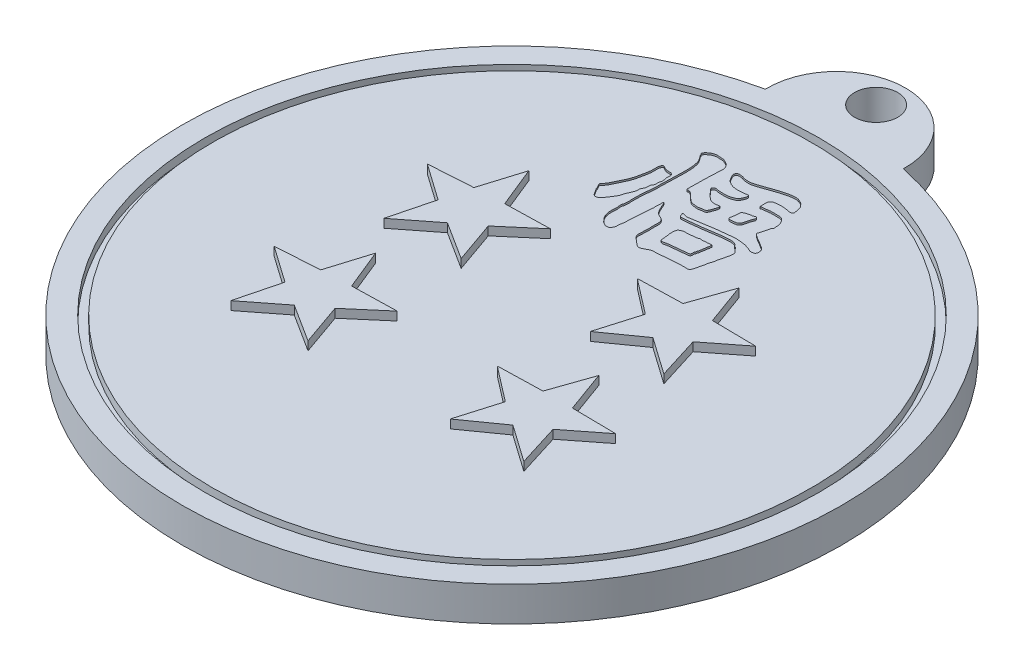
from build123d import *

# Parameters (mm, degrees)
SKETCH2_R           = 48.586041816
BOSS_EXTRUDE1_DEPTH = 5.08
SKETCH3_R           = 45.261162742
SKETCH3_R_2         = 44.114495039
CUT_EXTRUDE1_DEPTH  = 1.27
BOSS_EXTRUDE4_DEPTH = 1.27
SKETCH6_R           = 3.175
BOSS_EXTRUDE5_DEPTH = 5.08
CUT_EXTRUDE2_DEPTH  = 0.254


with BuildPart() as part:
    # Sketch2 → Boss-Extrude1 (new body)
    with BuildSketch(Plane(origin=(0, 0, 0), x_dir=(1, 0, 0), z_dir=(0, 1, 0))):
        with Locations(Location((0, 0, 0), (0, 0, 270))):
            Circle(SKETCH2_R)
    extrude(amount=BOSS_EXTRUDE1_DEPTH)

    # Sketch3 → Cut-Extrude1 (cut)
    with BuildSketch(Plane(origin=(0, 5.08, 0), x_dir=(1, 0, 0), z_dir=(0, 1, 0))):
        with Locations(Location((0, 0, 0), (0, 0, 270))):
            Circle(SKETCH3_R)
        with Locations(Location((0, 0, 0), (0, 0, 270))):
            Circle(SKETCH3_R_2, mode=Mode.SUBTRACT)
    extrude(amount=-CUT_EXTRUDE1_DEPTH, mode=Mode.SUBTRACT)

    # Sketch5 → Boss-Extrude4 (add)
    with BuildSketch(Plane(origin=(0, 5.08, 0), x_dir=(1, 0, 0), z_dir=(0, 1, 0))):
        Polygon((19.962692336, 2.42080456), (14.520621312, 6.248899488), (9.132932153, 2.42080456), (10.97803118, 8.674719156), (5.831176, 12.63682654), (12.395844117, 12.811625395), (14.520621312, 18.904336603), (16.734740144, 12.811625395), (23.190644529, 12.724225968), (18.016598415, 8.674719156), align=None)
        Polygon((13.248420457, -8.675505868), (15.373197652, -2.58279466), (17.587316485, -8.675505868), (24.043220869, -8.762905296), (18.869174756, -12.812412107), (20.815268677, -19.066326704), (15.373197652, -15.238231775), (9.985508494, -19.066326704), (11.830607521, -12.812412107), (6.68375234, -8.850304723), align=None)
        Polygon((-7.696814368, -9.215129018), (-14.261901219, -9.373422293), (-16.692881447, -3.396287267), (-18.595215819, -9.593429834), (-25.038383853, -10.008069147), (-19.665659674, -13.790012231), (-21.292139954, -20.134560381), (-16.051176371, -16.035444801), (-10.476310855, -19.58542786), (-12.636146644, -13.433115485), align=None)
        Polygon((-15.273489298, 5.757628034), (-9.698623782, 2.207644974), (-11.858459571, 8.359957349), (-6.919127295, 12.577943816), (-13.484214146, 12.419650541), (-15.915194374, 18.396785567), (-17.817528745, 12.199643), (-24.26069678, 11.785003687), (-18.887972601, 8.003060603), (-20.514452881, 1.658512453), align=None)
    extrude(amount=BOSS_EXTRUDE4_DEPTH)

    # Sketch6 → Boss-Extrude5 (add)
    with BuildSketch(Plane.XZ):
        with BuildLine():
            ThreePointArc((-10.16, -47.51187072), (0, -57.996644064), (10.16, -47.51187072))
            ThreePointArc((10.16, -47.51187072), (0, -48.586041816), (-10.16, -47.51187072))
        make_face()
        with Locations(Location((0, -53.666041816, 0), (0, 0, 270))):
            Circle(SKETCH6_R, mode=Mode.SUBTRACT)
    extrude(amount=-BOSS_EXTRUDE5_DEPTH)

    # Sketch8 → Cut-Extrude2 (cut)
    # profile 1 of 2: a face of its own
    with BuildSketch(Plane(origin=(0, 5.08, 0), x_dir=(1, 0, 0), z_dir=(0, 1, 0))):
        with BuildLine():
            add(Edge.make_bspline(
                [(-9.104848345, 21.317431694), (-9.003346051, 21.286647468), (-8.732647095, 21.279329128), (-8.445618917, 21.626370385), (-8.044697085, 22.011271969), (-7.797460235, 22.499600356), (-7.481449352, 22.929809827), (-7.285706933, 23.31825522), (-7.214177228, 23.795770809), (-7.010756161, 24.186758616), (-6.83011197, 24.643808959), (-6.622316609, 25.079138603), (-6.741430305, 25.585315983), (-6.431527486, 25.95121832), (-6.358479909, 26.365548715), (-6.440354454, 26.826861176), (-6.085696183, 27.118766471), (-6.189041229, 27.702083205), (-5.913044431, 28.311526098), (-6.230873285, 28.997010378), (-5.993091818, 29.635727169), (-6.491217066, 29.936112861), (-7.026573168, 29.817646436), (-7.467064941, 30.024518662), (-7.977918649, 30.3511747), (-8.161211447, 29.886074534), (-8.191311435, 29.450315644), (-8.152398152, 28.663584787), (-8.315933089, 27.77763375), (-8.53321778, 26.766298101), (-8.870609527, 25.761833146), (-9.41515839, 24.777842714), (-9.762517841, 23.881680268), (-10.151537925, 23.49958421), (-10.3810471, 23.178026492), (-10.071804629, 22.796847287), (-9.966154919, 22.313130325), (-9.598453722, 21.887797523), (-9.423430742, 21.485140893), (-9.198840957, 21.345938338), (-9.104848345, 21.317431694)],
                knots=[0, 0, 0, 0, 0.014630573, 0.035132969, 0.059376301, 0.094604923, 0.111141198, 0.135283802, 0.155282263, 0.178949579, 0.197060234, 0.225532505, 0.244950236, 0.265182514, 0.288670525, 0.303213642, 0.328412659, 0.341943786, 0.383250745, 0.415940039, 0.444177865, 0.463684072, 0.484306129, 0.519131226, 0.534692133, 0.554785085, 0.570505957, 0.601086519, 0.663574153, 0.698481307, 0.747794866, 0.812749429, 0.859505638, 0.879040139, 0.89271263, 0.908414068, 0.939586103, 0.963933795, 0.986451875, 1, 1, 1, 1], degree=3))
        make_face()
    # profile 2 of 2: a face of its own
    with BuildSketch(Plane(origin=(0, 5.08, 0), x_dir=(1, 0, 0), z_dir=(0, 1, 0))):
        with BuildLine():
            add(Edge.make_bspline(
                [(-3.520760811, 35.083924843), (-3.589856484, 35.129465567), (-3.783563784, 35.204450351), (-4.043533621, 35.381140107), (-4.390213777, 35.506268144), (-4.833761087, 35.496235122), (-5.296725256, 35.569763966), (-5.710402342, 35.473189403), (-5.986094193, 35.368053904), (-6.130357363, 35.158503673), (-6.440307711, 35.091549805), (-6.620078759, 34.836173389), (-6.735902924, 34.508455764), (-6.514475909, 34.404571636), (-6.499200515, 34.218567975), (-6.353215576, 34.09636012), (-6.300524669, 33.933373683), (-6.163591052, 33.853801957), (-6.145091114, 33.711395454), (-6.012431792, 33.600089853), (-5.957948886, 33.388378014), (-5.815758653, 33.203419425), (-5.81061032, 32.900519481), (-5.692504102, 32.571532894), (-5.689823445, 32.080019174), (-5.630301399, 31.535636381), (-5.635389467, 30.855940064), (-5.695592259, 30.158951511), (-5.685563485, 29.34856937), (-5.742267058, 28.585954412), (-5.744296563, 27.944972006), (-5.753316251, 27.42495417), (-5.707009426, 26.998180975), (-5.793701119, 26.592378281), (-5.769443491, 26.23468937), (-5.825525349, 25.818505109), (-5.93881339, 25.304011235), (-5.885200573, 24.747153245), (-5.920338873, 24.232012622), (-5.920990995, 23.813516043), (-5.958848496, 23.466859363), (-5.887968161, 23.215754353), (-5.909546267, 22.949413522), (-5.951044958, 22.695250033), (-5.955140079, 22.421934686), (-6.139941754, 22.092863058), (-5.952878911, 21.658650762), (-6.05031285, 21.209046963), (-6.012577932, 20.837581251), (-6.047469717, 20.581547254), (-6.03073377, 20.360798615), (-6.012182142, 20.187962925), (-5.984953557, 19.987529531), (-5.881056588, 19.848223728), (-5.899798203, 19.692224248), (-5.820078229, 19.525848715), (-5.703580912, 19.345556995), (-5.588333396, 19.134634924), (-5.418401646, 18.966917351), (-5.265880908, 18.790463006), (-5.129549817, 18.63457692), (-4.950965103, 18.516804635), (-4.761058, 18.403800179), (-4.52306871, 18.273166768), (-4.267336399, 18.319336042), (-4.019983797, 18.319841527), (-3.905853443, 18.523874983), (-3.726723583, 18.681309883), (-3.632451254, 18.984114612), (-3.686468926, 19.34207768), (-3.58351566, 19.770714021), (-3.507724922, 20.21141807), (-3.538826694, 20.925735872), (-3.440222585, 21.5666807), (-3.387677158, 22.228546149), (-3.39547542, 22.573483452), (-3.338502986, 22.920226848), (-3.363118104, 23.255321115), (-3.296829492, 23.61481331), (-3.284664019, 23.934733258), (-3.231029717, 24.222333708), (-3.320358331, 24.460749979), (-3.238992762, 24.695719974), (-3.278334652, 24.919827116), (-3.22311878, 25.164995083), (-3.25945278, 25.335917707), (-3.200779882, 25.623254983), (-3.099523398, 25.472566009), (-3.050740377, 25.364940535), (-2.94869592, 25.218808297), (-2.917501401, 25.033010608), (-2.826968609, 24.859973184), (-2.744389673, 24.710872394), (-2.666106418, 24.509734551), (-2.575680705, 24.315877717), (-2.429676714, 24.114457021), (-2.313513587, 23.882739805), (-2.073213447, 23.674970135), (-1.758109229, 23.483660627), (-1.428732176, 23.393500915), (-1.153325804, 23.181290784), (-0.999303549, 22.908880913), (-0.954672244, 22.510341085), (-1.015872957, 22.037773234), (-0.935799002, 21.308061719), (-0.984969184, 20.643187015), (-0.993764892, 19.979025631), (-1.070032824, 19.549324376), (-0.896389633, 19.218221018), (-0.736872325, 18.974399547), (-0.46120489, 18.796132796), (-0.178892307, 18.531457595), (0.152062359, 18.261680044), (0.476038297, 17.990005521), (0.87733161, 17.972899464), (1.213425508, 18.168295579), (1.575105718, 18.347668443), (2.073017737, 18.615926675), (2.651162091, 18.53627586), (3.215576644, 18.666885689), (3.726352007, 18.661225176), (4.239450303, 18.72007426), (4.775093951, 18.75416958), (5.364925451, 18.827376419), (6.004606008, 18.832540923), (6.606075086, 18.869554862), (7.087544371, 18.777916415), (7.397625883, 19.011873901), (7.445552282, 19.346570558), (7.570397957, 19.672807492), (7.625999392, 20.090873335), (7.794929158, 20.485762721), (7.80433204, 20.944576017), (7.941676891, 21.344939223), (8.077158772, 21.710215794), (8.079110654, 22.063414123), (8.194381149, 22.372261038), (8.257161971, 22.722259768), (8.366387599, 23.053957566), (8.38858232, 23.389678502), (8.530161256, 23.672850172), (8.492787138, 23.966442296), (8.599394103, 24.297210041), (8.277589453, 24.596880827), (8.034118587, 24.802630541), (7.851692225, 25.197677069), (7.64477239, 25.028650248), (7.545239673, 25.409742933), (7.294753546, 25.526424151), (7.026481586, 25.656220263), (6.659138035, 25.700147445), (6.212718072, 25.673306641), (5.589770931, 25.634222817), (4.925635493, 25.557576083), (4.224064243, 25.442782799), (3.613000908, 25.378234174), (3.100257735, 25.255698047), (2.568327118, 25.213036584), (2.009970458, 25.140819585), (1.388610784, 25.070852937), (0.827762163, 24.987972016), (0.370998924, 25.018471151), (0.048596099, 24.906068805), (-0.178179726, 25.002186201), (-0.321945877, 25.1436401), (-0.320311766, 25.348761229), (-0.565425716, 25.721185086), (0.135916803, 25.376700281), (0.549600924, 25.442163287), (1.105573494, 25.496267761), (1.665863245, 25.601367283), (2.350965622, 25.720095818), (3.006787263, 25.77289054), (3.657068342, 25.964949369), (4.228725901, 26.024053768), (4.812456559, 26.090205154), (5.336857593, 26.180439344), (5.81477338, 26.200143009), (6.269365133, 26.310240694), (6.740878392, 26.298159917), (7.231000029, 26.267918358), (7.69781807, 26.203296423), (8.207817139, 26.150882865), (8.653619209, 25.992293888), (9.032264659, 25.864945812), (9.357853234, 25.67927243), (9.687458317, 25.682921057), (10.003650005, 25.744495645), (10.142396045, 25.95432452), (10.207641358, 26.188798813), (10.104099349, 26.365960594), (10.158399398, 26.568721704), (9.982286157, 26.763361124), (9.831741368, 27.011435684), (9.546900217, 27.134042434), (9.285406947, 27.302826152), (9.002590267, 27.491106521), (8.697570267, 27.676352618), (8.369310903, 27.833905094), (8.122516704, 28.032087993), (7.848165092, 28.165044674), (7.648566174, 28.324271257), (7.592673815, 28.561442551), (7.721207004, 28.741685655), (7.719329064, 28.971501601), (7.849511049, 29.20562857), (7.887518068, 29.510455693), (8.006508704, 29.823124317), (8.022314851, 30.149110864), (8.25985222, 30.337318193), (8.183735494, 30.637626306), (8.193658305, 30.920372642), (8.156813307, 31.284002896), (7.992583705, 31.620212806), (7.79581181, 31.959751689), (7.594767824, 32.148039887), (7.388440525, 32.256531154), (7.203115713, 32.320138881), (6.949221091, 32.316252077), (6.59200789, 32.316078485), (6.202508809, 32.327504277), (5.778437933, 32.349065144), (5.471626652, 32.258425355), (5.127074513, 32.255137801), (4.851105548, 32.175925318), (4.613830954, 32.206862825), (4.393898598, 32.030104469), (4.442736172, 32.32998017), (4.40076427, 32.513551042), (4.424580168, 32.776505371), (4.393520976, 32.998352405), (4.402071473, 33.228515895), (4.541321457, 33.383575874), (4.654810488, 33.505922892), (4.735937459, 33.658002398), (4.931617607, 33.708258542), (5.206462237, 33.707928588), (5.611923622, 33.784120975), (6.113775785, 33.786639323), (6.609957532, 33.735082834), (7.003110842, 33.672623012), (7.289284773, 33.598083313), (7.510975504, 33.597928425), (7.639562998, 33.725925691), (7.785352093, 33.863395367), (7.696661353, 34.130147688), (7.676940656, 34.424285393), (7.577059114, 34.750300395), (7.468704804, 35.07985743), (7.231576134, 35.316393064), (7.03171338, 35.560143409), (6.688093344, 35.743739665), (6.294193073, 35.918434881), (5.851907808, 35.953526933), (5.412505944, 35.910992094), (4.983096041, 35.846895344), (4.527963143, 35.707946456), (4.093009272, 35.610087923), (3.581937106, 35.4538998), (3.002248008, 35.198178417), (2.314394324, 35.028042338), (1.688983119, 34.769947147), (1.107031682, 34.629262316), (0.604919431, 34.44503281), (0.167720762, 34.519184487), (-0.254432975, 34.488667103), (-0.597319357, 34.678151842), (-0.987079419, 34.716482427), (-1.306200955, 34.762232058), (-1.620373113, 34.586605929), (-1.672701161, 34.276426358), (-1.569726794, 34.00458517), (-1.397405, 33.781824982), (-1.311875481, 33.482992273), (-1.092722596, 33.269232893), (-0.945582115, 33.03325716), (-0.682103847, 33.011042786), (-0.585968043, 32.827736345), (-0.36040449, 32.817784887), (-0.176483091, 32.682271628), (0.105856431, 32.631531989), (0.529465796, 32.559654989), (1.10044176, 32.658566713), (1.638980596, 32.628752626), (2.468474099, 32.860840195), (2.041223129, 31.920059069), (1.786738356, 31.449652608), (1.38373494, 31.354928934), (0.969874906, 31.127964525), (0.370796956, 31.06644206), (-0.123073031, 31.080461807), (-0.609025506, 31.118513433), (-0.894105897, 31.135636215), (-1.173539759, 31.234357968), (-1.301399203, 31.059883497), (-1.589914332, 31.031619546), (-1.455589752, 30.718281053), (-1.281786057, 30.495992003), (-0.976313761, 30.220729785), (-0.662009313, 29.838873356), (-0.31320447, 29.536626191), (0.013455595, 29.270100242), (0.320439439, 29.164239939), (0.620214609, 29.170766701), (0.947791042, 29.100252651), (1.745747582, 29.488616364), (1.271299198, 28.312527943), (1.088428606, 27.858623923), (0.969831068, 27.657226423), (0.734431391, 27.588615321), (0.40972387, 27.592651602), (-0.031028633, 27.44408152), (-0.532827675, 27.504437364), (-0.943143842, 27.545546202), (-1.285387809, 27.705385287), (-1.586097038, 27.90799455), (-1.866897853, 28.238373378), (-2.185671677, 28.46750051), (-2.418794241, 28.767538782), (-2.700856249, 28.860872873), (-2.919845881, 28.98088581), (-3.153395936, 28.825603901), (-3.20198274, 29.150767465), (-3.176294672, 29.492277583), (-3.164395681, 30.040499176), (-3.145484643, 30.678740882), (-3.177716203, 31.395375719), (-3.126256908, 32.164144164), (-3.06441096, 32.93080722), (-3.124906197, 33.63038819), (-3.005212945, 34.177037018), (-3.138935855, 34.599122622), (-3.29151849, 34.874096884), (-3.449669527, 35.037068819), (-3.520760811, 35.083924843)],
                knots=[0, 0, 0, 0, 0.002019768, 0.004974467, 0.007629086, 0.010793259, 0.015676763, 0.018828711, 0.02107473, 0.022596702, 0.024739207, 0.028215777, 0.030103132, 0.03177807, 0.033004073, 0.034281483, 0.036191879, 0.036944, 0.037886265, 0.039391451, 0.040919349, 0.043071248, 0.044840566, 0.048066933, 0.051489012, 0.056662604, 0.06138691, 0.067957772, 0.07364511, 0.081048916, 0.086516261, 0.089204758, 0.093686482, 0.096843479, 0.09917351, 0.102343662, 0.107012262, 0.111882114, 0.115805003, 0.119538277, 0.122068647, 0.124179369, 0.125761621, 0.128499241, 0.130467988, 0.132297067, 0.137281916, 0.140631813, 0.143342142, 0.146280436, 0.146857716, 0.148710895, 0.150527104, 0.151677827, 0.152717471, 0.154151189, 0.156028088, 0.157977816, 0.159935846, 0.161785441, 0.163659194, 0.164926979, 0.166942163, 0.169110325, 0.171185354, 0.17323464, 0.174464044, 0.176509368, 0.179023037, 0.18171132, 0.185208895, 0.1895911, 0.192547909, 0.202508892, 0.205267227, 0.208670575, 0.210861046, 0.213765878, 0.216766673, 0.219683548, 0.221562467, 0.223762254, 0.225540528, 0.227337188, 0.229257627, 0.231206754, 0.232682984, 0.233333816, 0.23459964, 0.235917474, 0.237476943, 0.239118546, 0.240622711, 0.241616383, 0.244357031, 0.245781602, 0.24765078, 0.250596903, 0.25332019, 0.256577335, 0.258763821, 0.261598958, 0.26389604, 0.268389431, 0.273106701, 0.281645457, 0.284474863, 0.289360726, 0.291672581, 0.293352537, 0.296391593, 0.299482748, 0.302749214, 0.306848378, 0.309352418, 0.311918169, 0.316106985, 0.319287517, 0.32535597, 0.32959198, 0.333311608, 0.337698892, 0.342131564, 0.346341523, 0.352129967, 0.357595129, 0.361147776, 0.363388659, 0.366125033, 0.369021583, 0.371906653, 0.376291546, 0.37929094, 0.382904743, 0.386518545, 0.388656558, 0.391374494, 0.394436115, 0.397291205, 0.399809381, 0.402546675, 0.404675259, 0.406883845, 0.410387427, 0.413550038, 0.416460081, 0.416755168, 0.419436479, 0.421789005, 0.424017783, 0.426486013, 0.430694556, 0.434864081, 0.441648839, 0.446916195, 0.452129458, 0.456555621, 0.45968137, 0.465072267, 0.470225772, 0.474888116, 0.478765608, 0.481353542, 0.482655461, 0.484620994, 0.485690103, 0.487732633, 0.492167825, 0.495610621, 0.499655189, 0.505180942, 0.509637729, 0.516494044, 0.521109822, 0.526032369, 0.530414934, 0.535384853, 0.538938736, 0.541996463, 0.546683015, 0.550298145, 0.553933606, 0.558129716, 0.562696921, 0.565358471, 0.567846977, 0.571641316, 0.573103969, 0.575415219, 0.577284541, 0.578677852, 0.580085583, 0.581930349, 0.584546226, 0.587102909, 0.589176761, 0.592150219, 0.595338305, 0.597841689, 0.600968979, 0.602948916, 0.605263575, 0.606953313, 0.608212624, 0.610386244, 0.612294961, 0.614593181, 0.617740804, 0.620485559, 0.622032177, 0.624403946, 0.627072537, 0.629144833, 0.633144752, 0.63602763, 0.638666582, 0.639669925, 0.641688014, 0.643331735, 0.645795495, 0.650377304, 0.652809478, 0.656044606, 0.658009338, 0.661198809, 0.662660354, 0.66422062, 0.665358179, 0.667855324, 0.669624459, 0.671492351, 0.673404323, 0.674895267, 0.676375466, 0.677525238, 0.678874621, 0.680933819, 0.684307092, 0.6887934, 0.693077325, 0.696442306, 0.698375038, 0.700412317, 0.701273032, 0.702744398, 0.704879553, 0.707277923, 0.710108675, 0.713088253, 0.715538665, 0.718134959, 0.720674815, 0.724879386, 0.728527996, 0.731277507, 0.735608436, 0.739036774, 0.742818595, 0.74643318, 0.751997451, 0.758163191, 0.76359702, 0.768354599, 0.772775213, 0.776248202, 0.778948605, 0.782884075, 0.785337379, 0.788476051, 0.790478156, 0.79341676, 0.795105901, 0.797491105, 0.800190854, 0.802394185, 0.804931392, 0.806401536, 0.808312288, 0.809143927, 0.811628159, 0.813645568, 0.816032877, 0.822076307, 0.827142851, 0.830177742, 0.838846511, 0.840203756, 0.843450386, 0.847917749, 0.851873502, 0.85774559, 0.860034777, 0.863575353, 0.865133343, 0.866177679, 0.868443506, 0.87012468, 0.872636863, 0.875866036, 0.879848597, 0.884697844, 0.887032624, 0.890047084, 0.892336271, 0.894218974, 0.898361948, 0.907786759, 0.910014105, 0.911531002, 0.913105974, 0.9156458, 0.919465217, 0.924119378, 0.927766356, 0.929372684, 0.933240889, 0.936470061, 0.939822505, 0.942763924, 0.945390002, 0.946913461, 0.948656778, 0.94994618, 0.953045039, 0.958022196, 0.962752736, 0.968706366, 0.975367527, 0.98147295, 0.987335688, 0.992404472, 0.994610169, 0.997921898, 1, 1, 1, 1], degree=3))
        make_face()
        with BuildLine():
            add(Edge.make_bspline(
                [(1.450213942, 20.547539352), (1.490799237, 20.512653883), (1.66828616, 20.463118601), (1.921835696, 20.468227206), (2.222208873, 20.557805543), (2.557558477, 20.62209593), (2.974535249, 20.622218314), (3.381161402, 20.71402697), (3.780485068, 20.739991426), (4.113701091, 20.748252352), (4.380875092, 20.795983502), (4.596470164, 20.818363494), (4.792974404, 20.84937653), (5.015585217, 20.879541145), (5.226643991, 20.884862435), (5.38746812, 21.008655576), (5.396550494, 21.172089003), (5.400646262, 21.319891514), (5.372697752, 21.488933572), (5.510226325, 21.629047829), (5.440501615, 21.830176464), (5.576568591, 21.93301027), (5.561567559, 22.075249946), (5.585094857, 22.181756091), (5.624763451, 22.346621171), (5.63395899, 22.524894704), (5.674966114, 22.740271915), (5.688106605, 22.947188596), (5.749091048, 23.158378533), (5.818368877, 23.355186082), (5.728289898, 23.536855134), (5.91431309, 23.665238581), (5.601340814, 23.676982262), (5.414478897, 23.68801375), (5.192942162, 23.599050267), (4.934693994, 23.627680826), (4.699525726, 23.603228332), (4.463119609, 23.504657594), (4.206402513, 23.691988314), (3.876987515, 23.454189996), (3.511291622, 23.461580072), (3.136414176, 23.418315893), (2.693332191, 23.321448609), (2.24648015, 23.351122731), (1.818878789, 23.363117132), (1.622133691, 23.156165864), (1.327830933, 23.118281261), (1.298022156, 22.828111731), (1.185414636, 22.585849564), (1.246286941, 22.287368784), (1.215570991, 21.987282623), (1.304652381, 21.654263285), (1.308999526, 21.290188216), (1.38683121, 20.928724219), (1.362754335, 20.622716073), (1.450213942, 20.547539352)],
                knots=[0, 0, 0, 0, 0.012641468, 0.036145391, 0.055719513, 0.079986945, 0.110064029, 0.145637033, 0.169912598, 0.196740545, 0.217782966, 0.22863791, 0.243741113, 0.260855957, 0.277562388, 0.288561046, 0.300950211, 0.310742156, 0.321392914, 0.336155207, 0.347447725, 0.361563841, 0.365518206, 0.377609619, 0.385076356, 0.402274786, 0.416097992, 0.432608995, 0.446966777, 0.463768619, 0.477024171, 0.482772689, 0.500631852, 0.511105085, 0.531205112, 0.547628093, 0.567272255, 0.582587791, 0.599473249, 0.626627455, 0.657768101, 0.678590142, 0.708435471, 0.75506749, 0.777787252, 0.795008943, 0.814622437, 0.832540733, 0.850233511, 0.872749537, 0.895585512, 0.915307648, 0.946810685, 0.972758167, 1, 1, 1, 1], degree=3))
        make_face(mode=Mode.SUBTRACT)
        with BuildLine():
            add(Edge.make_bspline(
                [(3.768859651, 29.84799876), (3.772450313, 29.721508097), (3.759472413, 29.454265458), (3.69839164, 29.089653887), (3.668387289, 28.757133799), (3.567348389, 28.542995115), (3.598463206, 28.33488969), (3.930453364, 28.1835549), (4.34273883, 28.30014596), (5.243570423, 28.328241574), (5.302724673, 29.370186802), (5.527884677, 29.980251643), (5.67133577, 30.243840425), (5.609791878, 30.526950188), (5.312276548, 30.572236982), (5.151553394, 30.356663236), (4.890166499, 30.406490472), (4.613130657, 30.302697122), (4.269626412, 30.24077293), (3.957348632, 30.121048432), (3.76591641, 29.936603319), (3.768606447, 29.856918534), (3.768859651, 29.84799876)],
                knots=[0, 0, 0, 0, 0.053170181, 0.113400048, 0.15663385, 0.193344398, 0.211968123, 0.238221603, 0.331272566, 0.393900259, 0.590805732, 0.651017984, 0.6799641, 0.716019269, 0.753906015, 0.776240174, 0.820726255, 0.850877618, 0.902202765, 0.966526775, 0.996250585, 1, 1, 1, 1], degree=3))
        make_face(mode=Mode.SUBTRACT)
    extrude(amount=-CUT_EXTRUDE2_DEPTH, mode=Mode.SUBTRACT)


solid = part.part
